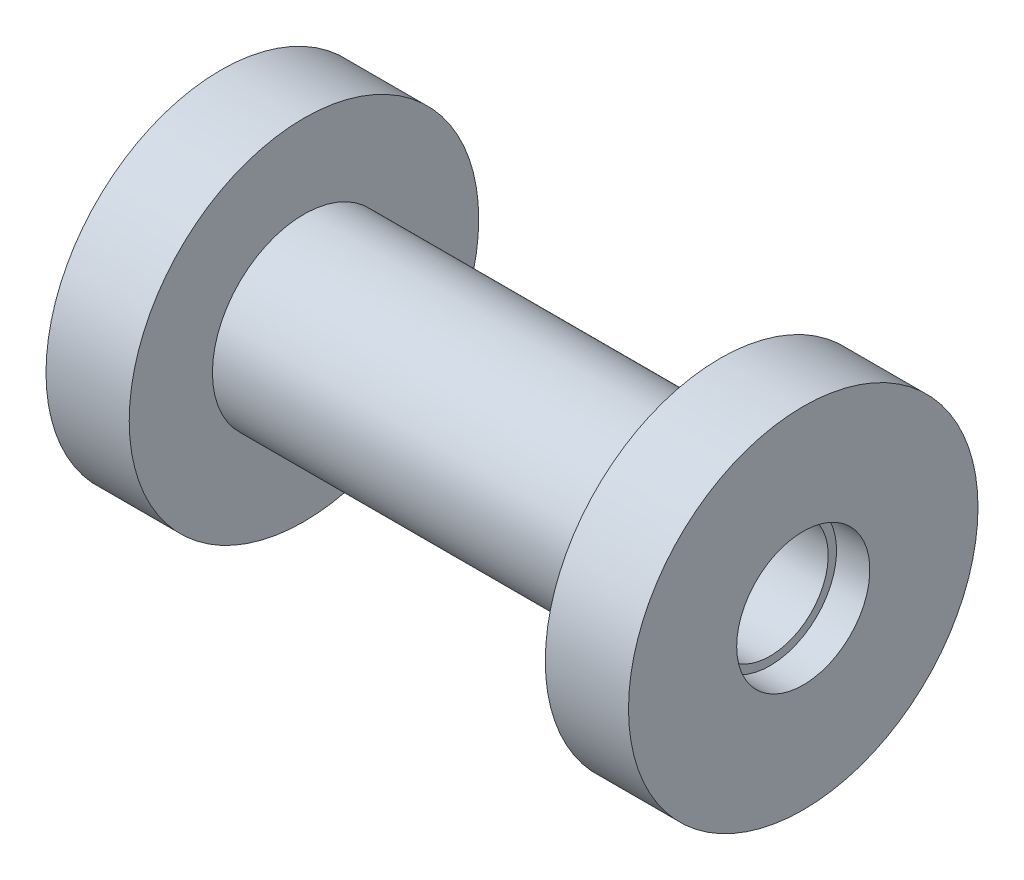
from build123d import *


with BuildPart() as part:
    # 草图1 → 旋转1 (revolve)
    with BuildSketch(Plane(origin=(0, 0, 0), x_dir=(1, 0, 0), z_dir=(0, 1, 0)), mode=Mode.PRIVATE) as revolve_1_sk:
        Polygon((66, 7), (66, 8), (70, 8), (70, 21), (60, 21), (60, 11), (10, 11), (10, 21), (0, 21), (0, 8), (4, 8), (4, 7), align=None)
    revolve(revolve_1_sk.sketch.rotate(Axis((-74.515541445, 0, 0), (1, 0, 0)), 180), axis=Axis((-74.515541445, 0, 0), (1, 0, 0)))


solid = part.part
